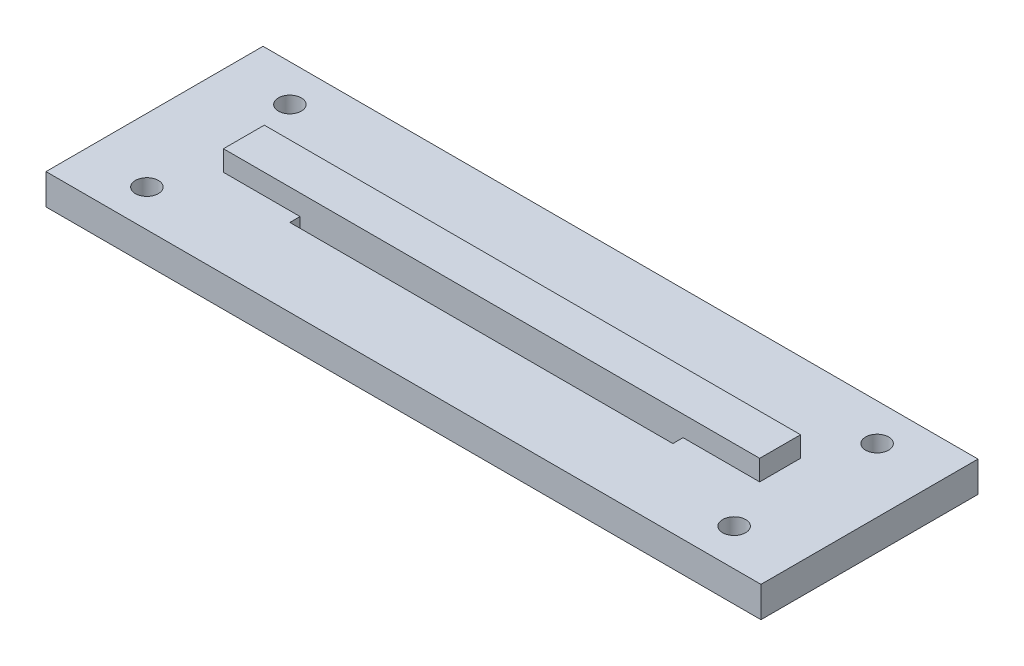
from build123d import *

# Parameters (mm, degrees)
F_01_BASE_PROFILE_W           = 280
F_01_BASE_PROFILE_H           = 85
F_01_BASE_PROFILE_R           = 4.5
F_01_BASE_PROFILE_W_2         = 150
F_01_BASE_PROFILE_H_2         = 24
F_01_BASE_EXTRUDE_DEPTH       = 12
F_02_BOSS_PROFILE_W           = 210
F_02_BOSS_PROFILE_H           = 16
F_02_REINFORCEMENT_BOSS_DEPTH = 20


with BuildPart() as part:
    # 01_Base_Profile → 01_Base_Extrude (new body)
    with BuildSketch(Plane(origin=(0, 0, 0), x_dir=(1, 0, 0), z_dir=(0, 1, 0))):
        Rectangle(F_01_BASE_PROFILE_W, F_01_BASE_PROFILE_H)
        with Locations(Location((-115, -28, 0), (0, 0, 270))):
            Circle(F_01_BASE_PROFILE_R, mode=Mode.SUBTRACT)
        with Locations(Location((115, -28, 0), (0, 0, 270))):
            Circle(F_01_BASE_PROFILE_R, mode=Mode.SUBTRACT)
        with Locations(Location((-115, 28, 0), (0, 0, 270))):
            Circle(F_01_BASE_PROFILE_R, mode=Mode.SUBTRACT)
        with Locations(Location((115, 28, 0), (0, 0, 270))):
            Circle(F_01_BASE_PROFILE_R, mode=Mode.SUBTRACT)
        Rectangle(F_01_BASE_PROFILE_W_2, F_01_BASE_PROFILE_H_2, mode=Mode.SUBTRACT)
    extrude(amount=F_01_BASE_EXTRUDE_DEPTH)

    # 02_Boss_Profile → 02_Reinforcement_Boss (add)
    with BuildSketch(Plane(origin=(0, 0, 0), x_dir=(1, 0, 0), z_dir=(0, 1, 0))):
        Rectangle(F_02_BOSS_PROFILE_W, F_02_BOSS_PROFILE_H)
    extrude(amount=F_02_REINFORCEMENT_BOSS_DEPTH)


solid = part.part
